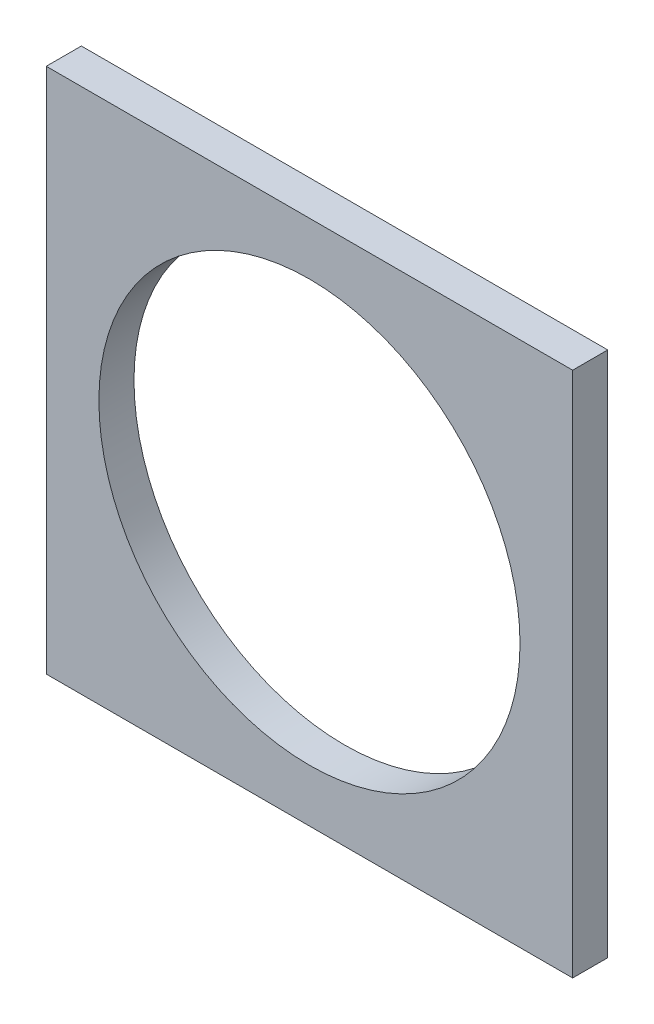
from build123d import *

# Parameters (mm, degrees)
SKETCH1_W           = 30
SKETCH1_H           = 30
SKETCH1_R           = 12
BOSS_EXTRUDE1_DEPTH = 2


with BuildPart() as part:
    # Sketch1 → Boss-Extrude1 (new body)
    with BuildSketch(Plane.XY):
        Rectangle(SKETCH1_W, SKETCH1_H)
        Circle(SKETCH1_R, mode=Mode.SUBTRACT)
    extrude(amount=BOSS_EXTRUDE1_DEPTH)


solid = part.part
